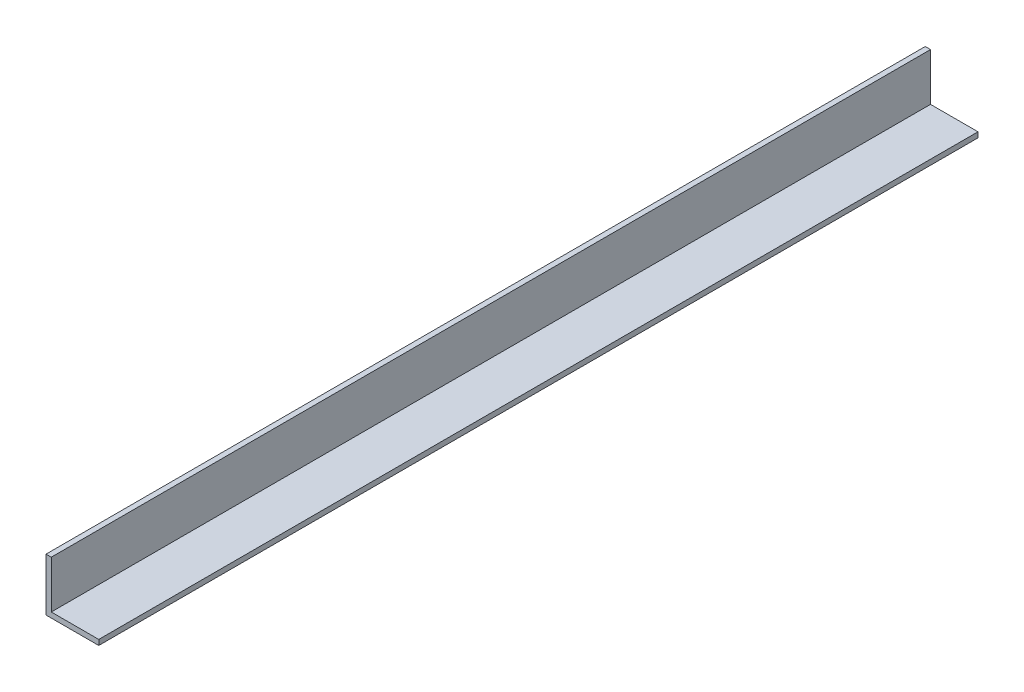
from build123d import *

# Parameters (mm, degrees)
EXTRUDE_1_DEPTH = 500


with BuildPart() as part:
    # 草图1 → 凸台-拉伸1 (new body)
    with BuildSketch(Plane.XY):
        Polygon((0, 0), (0, 27), (-3, 27), (-3, -3), (27, -3), (27, 0), align=None)
    extrude(amount=EXTRUDE_1_DEPTH)


solid = part.part
